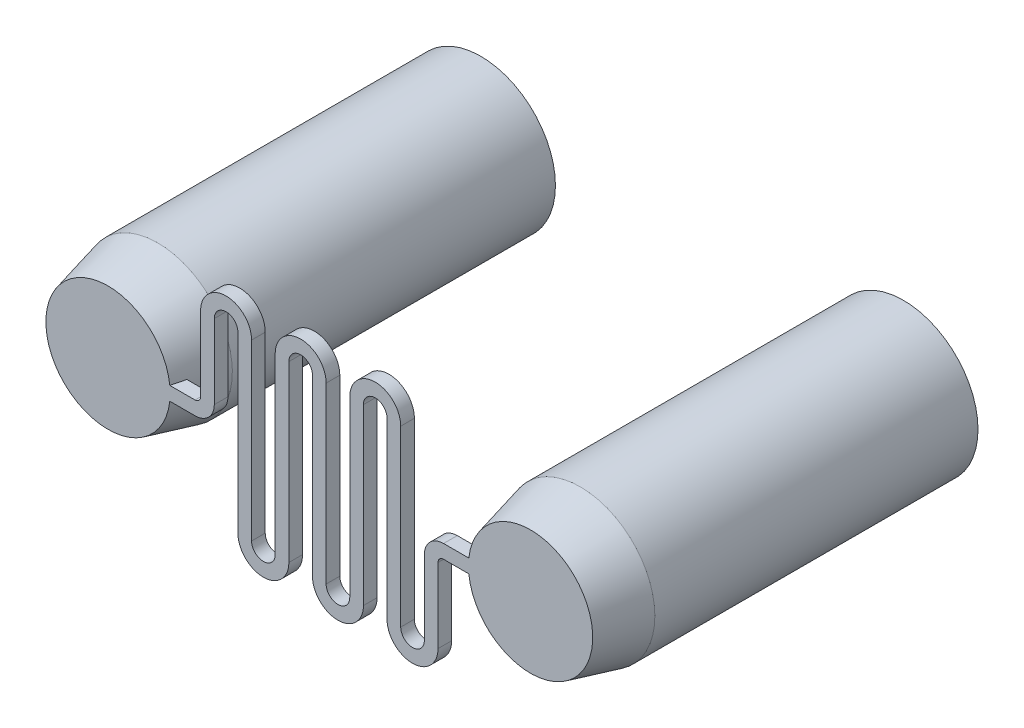
from build123d import *

# Parameters (mm, degrees)
BOSS_EXTRUDE1_DEPTH = 1.1
SKETCH5_R           = 5
CUT_EXTRUDE1_DEPTH  = 28


with BuildPart() as part:
    # Sketch2 → Boss-Extrude1 (new body)
    with BuildSketch(Plane.XY):
        with BuildLine():
            Line((-20.5, -0.55), (-13.5, -0.55))
            ThreePointArc((-13.5, -0.55), (-12.403984489, -0.096015511), (-11.95, 1))
            Line((-11.95, 1), (-11.95, 7))
            ThreePointArc((-11.95, 7), (-11, 7.95), (-10.05, 7))
            Line((-10.05, 7), (-10.05, 0))
            Line((-10.05, 0), (-10.05, -7))
            ThreePointArc((-10.05, -7), (-8, -9.05), (-5.95, -7))
            Line((-5.95, -7), (-5.95, 0))
            Line((-5.95, 0), (-5.95, 7))
            ThreePointArc((-5.95, 7), (-5, 7.95), (-4.05, 7))
            Line((-4.05, 7), (-4.05, 0))
            Line((-4.05, 0), (-4.05, -7))
            ThreePointArc((-4.05, -7), (-2, -9.05), (0.05, -7))
            Line((0.05, -7), (0.05, 0))
            Line((0.05, 0), (0.05, 7))
            ThreePointArc((0.05, 7), (1, 7.95), (1.95, 7))
            Line((1.95, 7), (1.95, 0))
            Line((1.95, 0), (1.95, -7))
            ThreePointArc((1.95, -7), (4, -9.05), (6.05, -7))
            Line((6.05, -7), (6.05, -1))
            ThreePointArc((6.05, -1), (6.181801948, -0.681801948), (6.5, -0.55))
            Line((6.5, -0.55), (13.5, -0.55))
            ThreePointArc((13.5, -0.55), (14.05, 0), (13.5, 0.55))
            Line((13.5, 0.55), (6.5, 0.55))
            ThreePointArc((6.5, 0.55), (5.403984489, 0.096015511), (4.95, -1))
            Line((4.95, -1), (4.95, -7))
            ThreePointArc((4.95, -7), (4, -7.95), (3.05, -7))
            Line((3.05, -7), (3.05, 0))
            Line((3.05, 0), (3.05, 7))
            ThreePointArc((3.05, 7), (1, 9.05), (-1.05, 7))
            Line((-1.05, 7), (-1.05, 0))
            Line((-1.05, 0), (-1.05, -7))
            ThreePointArc((-1.05, -7), (-2, -7.95), (-2.95, -7))
            Line((-2.95, -7), (-2.95, 0))
            Line((-2.95, 0), (-2.95, 7))
            ThreePointArc((-2.95, 7), (-5, 9.05), (-7.05, 7))
            Line((-7.05, 7), (-7.05, 0))
            Line((-7.05, 0), (-7.05, -7))
            ThreePointArc((-7.05, -7), (-8, -7.95), (-8.95, -7))
            Line((-8.95, -7), (-8.95, 0))
            Line((-8.95, 0), (-8.95, 7))
            ThreePointArc((-8.95, 7), (-11, 9.05), (-13.05, 7))
            Line((-13.05, 7), (-13.05, 1))
            ThreePointArc((-13.05, 1), (-13.181801948, 0.681801948), (-13.5, 0.55))
            Line((-13.5, 0.55), (-20.5, 0.55))
            ThreePointArc((-20.5, 0.55), (-21.05, 0), (-20.5, -0.55))
        make_face()
    extrude(amount=BOSS_EXTRUDE1_DEPTH)

    # Sketch3 → Revolve1 (revolve)
    with BuildSketch(Plane(origin=(0, 0, 0), x_dir=(-1, 0, 0), z_dir=(0, -1, 0)), mode=Mode.PRIVATE) as revolve1_sk:
        Polygon((20.5, -1.1), (25.5, -1.1), (26.5, 2.9), (26.5, 28.9), (20.5, 28.9), align=None)
    revolve(revolve1_sk.sketch.rotate(Axis((-20.5, 0, 1.1), (0, 0, -1)), 173.684684431), axis=Axis((-20.5, 0, 1.1), (0, 0, -1)))

    # Sketch4 → Revolve2 (revolve)
    with BuildSketch(Plane(origin=(0, 0, 0), x_dir=(-1, 0, 0), z_dir=(0, -1, 0)), mode=Mode.PRIVATE) as revolve2_sk:
        Polygon((-13.5, -1.1), (-18.5, -1.1), (-19.5, 2.9), (-19.5, 28.9), (-13.5, 28.9), align=None)
    revolve(revolve2_sk.sketch.rotate(Axis((13.5, 0, 1.1), (0, 0, -1)), 174.015159457), axis=Axis((13.5, 0, 1.1), (0, 0, -1)))

    # Sketch5 → Cut-Extrude1 (cut)
    with BuildSketch(Plane(origin=(0, 0, -28.9), x_dir=(-1, 0, 0), z_dir=(0, 0, -1))):
        with Locations((-13.5, 0)):
            Circle(SKETCH5_R)
        with Locations((20.5, 0)):
            Circle(SKETCH5_R)
    extrude(amount=-CUT_EXTRUDE1_DEPTH, mode=Mode.SUBTRACT)


solid = part.part
